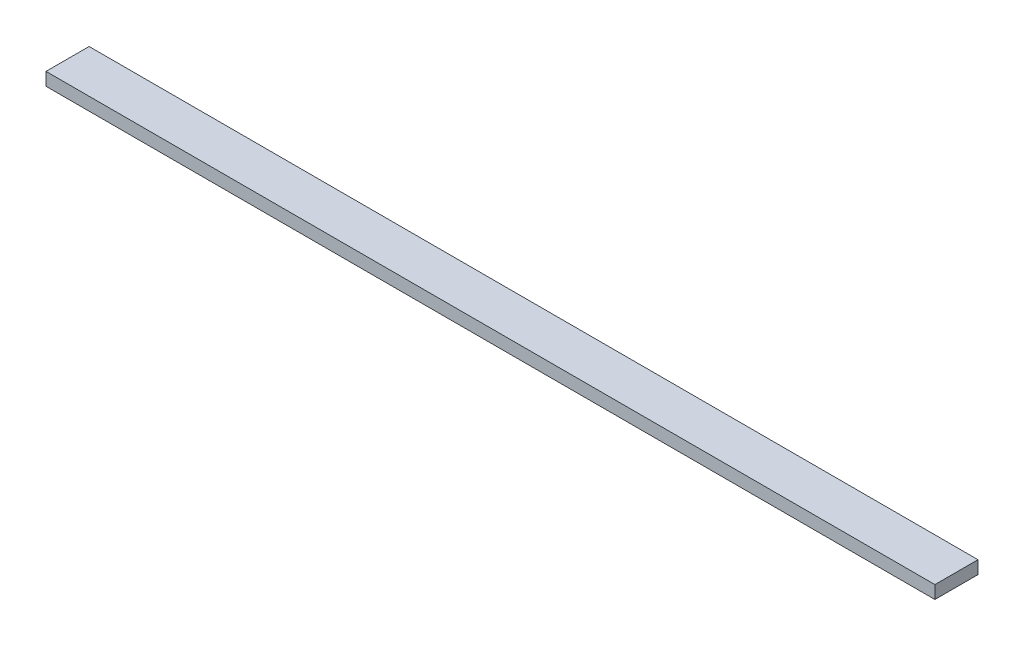
from build123d import *

# Parameters (mm, degrees)
SKETCH1_W           = 206.24
SKETCH1_H           = 10
BOSS_EXTRUDE1_DEPTH = 3


with BuildPart() as part:
    # Sketch1 → Boss-Extrude1 (new body)
    with BuildSketch(Plane(origin=(0, 0, 0), x_dir=(1, 0, 0), z_dir=(0, 1, 0))):
        with Locations((0, 5)):
            Rectangle(SKETCH1_W, SKETCH1_H)
    extrude(amount=BOSS_EXTRUDE1_DEPTH)


solid = part.part
